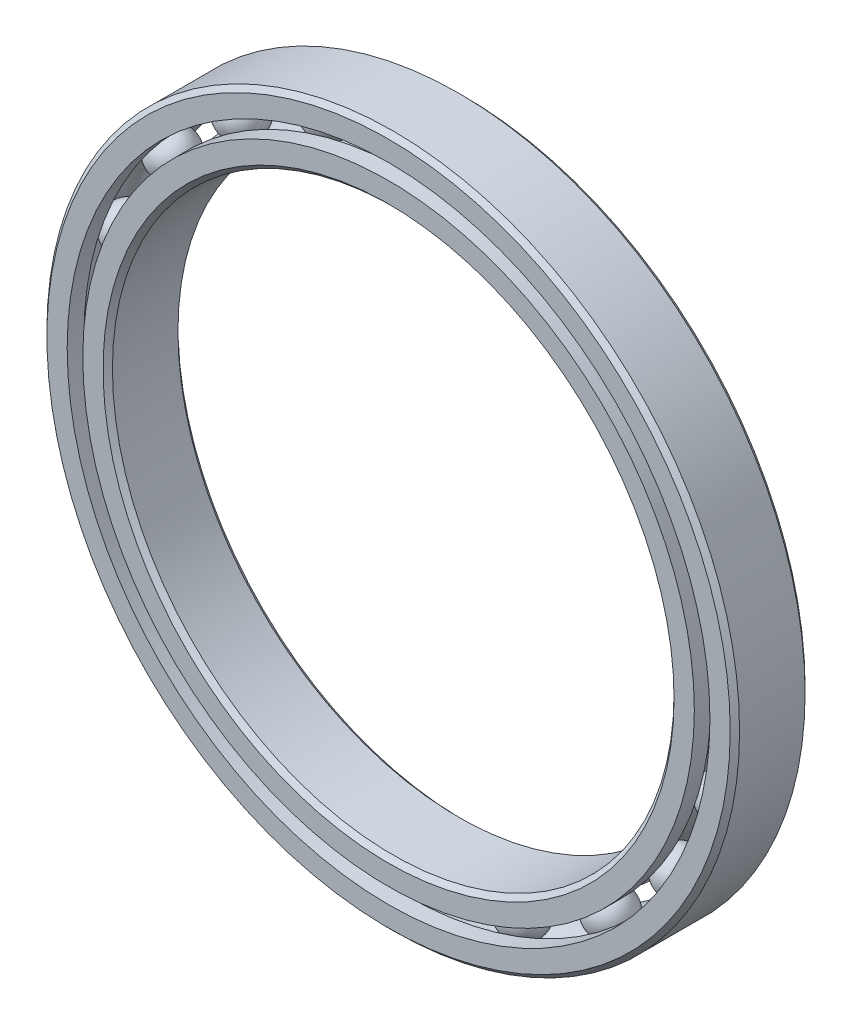
from build123d import *

# Parameters (mm, degrees)
CIRPATTERN1_COUNT = 20


with BuildPart() as part:
    # Sketch1 → Revolve1 (revolve)
    with BuildSketch(Plane(origin=(0, 0, 0), x_dir=(0, 0, -1), z_dir=(1, 0, 0)), mode=Mode.PRIVATE) as revolve1_sk:
        with BuildLine():
            Line((1.75, 18.5), (-1.75, 18.5))
            Line((-1.75, 18.5), (-2, 18.25))
            Line((-2, 18.25), (-2, 17.166800235))
            Line((-2, 17.166800235), (-1.111111111, 17.166800235))
            ThreePointArc((-1.111111111, 17.166800235), (0, 17.936714092), (1.111111111, 17.166800235))
            Line((1.111111111, 17.166800235), (2, 17.166800235))
            Line((2, 17.166800235), (2, 18.25))
            Line((2, 18.25), (1.75, 18.5))
        make_face()
    revolve(revolve1_sk.sketch.rotate(Axis((0, 0, 2), (0, 0, -1)), 90), axis=Axis((0, 0, 2), (0, 0, -1)))


with BuildPart() as body_2:
    # Sketch3 → Revolve3 (revolve)
    with BuildSketch(Plane(origin=(0, 0, 0), x_dir=(0, 0, -1), z_dir=(1, 0, 0)), mode=Mode.PRIVATE) as revolve3_sk:
        with BuildLine():
            Line((-2, 16.333199765), (-1.111111111, 16.333199765))
            ThreePointArc((-1.111111111, 16.333199765), (0, 15.563285908), (1.111111111, 16.333199765))
            Line((1.111111111, 16.333199765), (2, 16.333199765))
            Line((2, 16.333199765), (2, 15.25))
            Line((2, 15.25), (1.75, 15))
            Line((1.75, 15), (-1.75, 15))
            Line((-1.75, 15), (-2, 15.25))
            Line((-2, 15.25), (-2, 16.333199765))
        make_face()
    revolve(revolve3_sk.sketch.rotate(Axis((0, 0, 2), (0, 0, -1)), 90), axis=Axis((0, 0, 2), (0, 0, -1)))


with BuildPart() as body_3:
    # Sketch4 → Revolve4 (revolve)
    with BuildSketch(Plane(origin=(0, 0, 0), x_dir=(0, 0, -1), z_dir=(1, 0, 0))):
        with BuildLine():
            Line((-1.186714092, 16.75), (1.186714092, 16.75))
            ThreePointArc((1.186714092, 16.75), (0, 17.936714092), (-1.186714092, 16.75))
        make_face()
    revolve(axis=Axis((0, 16.75, 1.186714092), (0, 0, -1)))


with BuildPart() as cirpattern1_1:
    # CirPattern1: pattern copy
    add(body_3.part.rotate(Axis((0, 0, 0), (0, 0, 1)), 1 * 360 / CIRPATTERN1_COUNT))


with BuildPart() as cirpattern1_2:
    # CirPattern1: pattern copy
    add(body_3.part.rotate(Axis((0, 0, 0), (0, 0, 1)), 2 * 360 / CIRPATTERN1_COUNT))


with BuildPart() as cirpattern1_3:
    # CirPattern1: pattern copy
    add(body_3.part.rotate(Axis((0, 0, 0), (0, 0, 1)), 3 * 360 / CIRPATTERN1_COUNT))


with BuildPart() as cirpattern1_4:
    # CirPattern1: pattern copy
    add(body_3.part.rotate(Axis((0, 0, 0), (0, 0, 1)), 4 * 360 / CIRPATTERN1_COUNT))


with BuildPart() as cirpattern1_5:
    # CirPattern1: pattern copy
    add(body_3.part.rotate(Axis((0, 0, 0), (0, 0, 1)), 5 * 360 / CIRPATTERN1_COUNT))


with BuildPart() as cirpattern1_6:
    # CirPattern1: pattern copy
    add(body_3.part.rotate(Axis((0, 0, 0), (0, 0, 1)), 6 * 360 / CIRPATTERN1_COUNT))


with BuildPart() as cirpattern1_7:
    # CirPattern1: pattern copy
    add(body_3.part.rotate(Axis((0, 0, 0), (0, 0, 1)), 7 * 360 / CIRPATTERN1_COUNT))


with BuildPart() as cirpattern1_8:
    # CirPattern1: pattern copy
    add(body_3.part.rotate(Axis((0, 0, 0), (0, 0, 1)), 8 * 360 / CIRPATTERN1_COUNT))


with BuildPart() as cirpattern1_9:
    # CirPattern1: pattern copy
    add(body_3.part.rotate(Axis((0, 0, 0), (0, 0, 1)), 9 * 360 / CIRPATTERN1_COUNT))


with BuildPart() as cirpattern1_10:
    # CirPattern1: pattern copy
    add(body_3.part.rotate(Axis((0, 0, 0), (0, 0, 1)), 10 * 360 / CIRPATTERN1_COUNT))


with BuildPart() as cirpattern1_11:
    # CirPattern1: pattern copy
    add(body_3.part.rotate(Axis((0, 0, 0), (0, 0, 1)), 11 * 360 / CIRPATTERN1_COUNT))


with BuildPart() as cirpattern1_12:
    # CirPattern1: pattern copy
    add(body_3.part.rotate(Axis((0, 0, 0), (0, 0, 1)), 12 * 360 / CIRPATTERN1_COUNT))


with BuildPart() as cirpattern1_13:
    # CirPattern1: pattern copy
    add(body_3.part.rotate(Axis((0, 0, 0), (0, 0, 1)), 13 * 360 / CIRPATTERN1_COUNT))


with BuildPart() as cirpattern1_14:
    # CirPattern1: pattern copy
    add(body_3.part.rotate(Axis((0, 0, 0), (0, 0, 1)), 14 * 360 / CIRPATTERN1_COUNT))


with BuildPart() as cirpattern1_15:
    # CirPattern1: pattern copy
    add(body_3.part.rotate(Axis((0, 0, 0), (0, 0, 1)), 15 * 360 / CIRPATTERN1_COUNT))


with BuildPart() as cirpattern1_16:
    # CirPattern1: pattern copy
    add(body_3.part.rotate(Axis((0, 0, 0), (0, 0, 1)), 16 * 360 / CIRPATTERN1_COUNT))


with BuildPart() as cirpattern1_17:
    # CirPattern1: pattern copy
    add(body_3.part.rotate(Axis((0, 0, 0), (0, 0, 1)), 17 * 360 / CIRPATTERN1_COUNT))


with BuildPart() as cirpattern1_18:
    # CirPattern1: pattern copy
    add(body_3.part.rotate(Axis((0, 0, 0), (0, 0, 1)), 18 * 360 / CIRPATTERN1_COUNT))


with BuildPart() as cirpattern1_19:
    # CirPattern1: pattern copy
    add(body_3.part.rotate(Axis((0, 0, 0), (0, 0, 1)), 19 * 360 / CIRPATTERN1_COUNT))


solid = Compound([part.part, body_2.part, body_3.part, cirpattern1_1.part, cirpattern1_2.part, cirpattern1_3.part, cirpattern1_4.part, cirpattern1_5.part, cirpattern1_6.part, cirpattern1_7.part, cirpattern1_8.part, cirpattern1_9.part, cirpattern1_10.part, cirpattern1_11.part, cirpattern1_12.part, cirpattern1_13.part, cirpattern1_14.part, cirpattern1_15.part, cirpattern1_16.part, cirpattern1_17.part, cirpattern1_18.part, cirpattern1_19.part])
